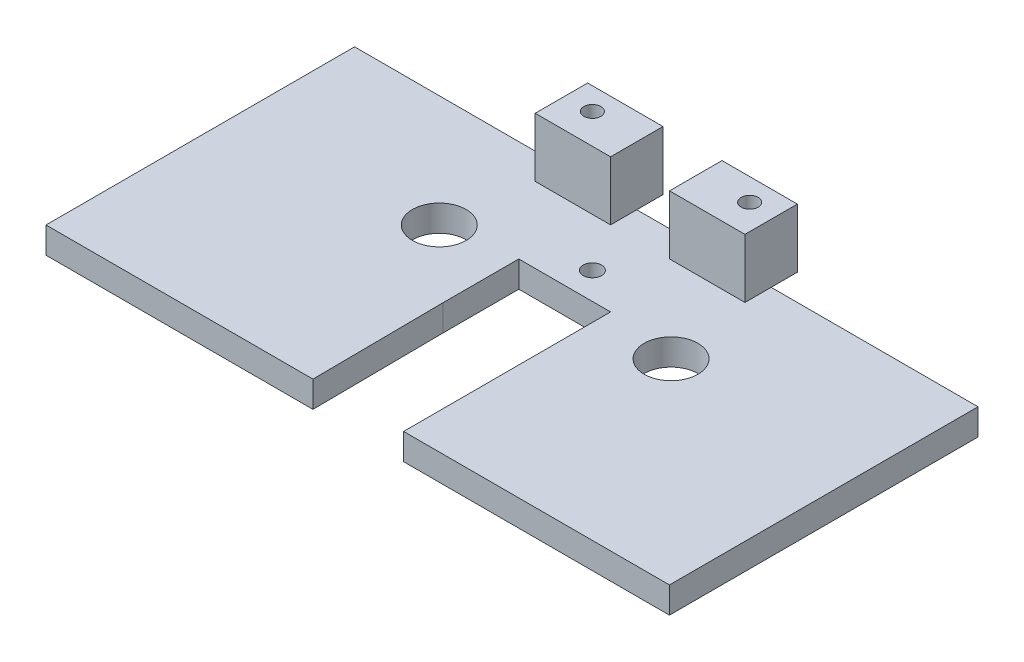
from build123d import *

# Parameters (mm, degrees)
SKETCH2_R           = 2.05
SKETCH2_R_2         = 0.700643725
BOSS_EXTRUDE1_DEPTH = 2
SKETCH3_W           = 5.75
SKETCH3_H           = 4
BOSS_EXTRUDE2_DEPTH = 4.5
SKETCH4_R           = 0.65
CUT_EXTRUDE1_DEPTH  = 18.578324987
BOSS_EXTRUDE3_DEPTH = 2


with BuildPart() as part:
    # Sketch2 → Boss-Extrude1 (new body)
    with BuildSketch(Plane(origin=(0, 0, 0), x_dir=(1, 0, 0), z_dir=(0, 1, 0))):
        Polygon((-3.5, -6.76929), (-3.5, -0.98071), (3.5, -0.98071), (3.5, -6.76929), (13.7785, -6.76929), (13.7785, 6.76929), (-13.7785, 6.76929), (-13.7785, -6.76929), align=None)
        with Locations(Location((-8.7785, -1.76929, 0), (0, 0, 270))):
            Circle(SKETCH2_R, mode=Mode.SUBTRACT)
        with Locations(Location((8.9015, -1.76929, 0), (0, 0, 270))):
            Circle(SKETCH2_R, mode=Mode.SUBTRACT)
        with Locations(Location((0.0585, 1.07400228, 0), (0, 0, 270))):
            Circle(SKETCH2_R_2, mode=Mode.SUBTRACT)
    extrude(amount=BOSS_EXTRUDE1_DEPTH)

    # Sketch3 → Boss-Extrude2 (add)
    with BuildSketch(Plane(origin=(0, 2, 0), x_dir=(1, 0, 0), z_dir=(0, 1, 0))):
        with Locations((-5.125, 6.76929)):
            Rectangle(SKETCH3_W, SKETCH3_H)
        with Locations((5.125, 6.76929)):
            Rectangle(SKETCH3_W, SKETCH3_H)
    extrude(amount=BOSS_EXTRUDE2_DEPTH)

    # Sketch4 → Cut-Extrude1 (cut, through all)
    with BuildSketch(Plane(origin=(0, 6.5, 0), x_dir=(1, 0, 0), z_dir=(0, 1, 0))):
        with Locations(Location((-5.94, 7.06929, 0), (0, 0, 270))):
            Circle(SKETCH4_R)
        with Locations(Location((6.06, 7.06929, 0), (0, 0, 270))):
            Circle(SKETCH4_R)
    extrude(amount=-CUT_EXTRUDE1_DEPTH, mode=Mode.SUBTRACT)

    # Sketch5 → Boss-Extrude3 (add)
    with BuildSketch(Plane(origin=(0, 2, 0), x_dir=(1, 0, 0), z_dir=(0, 1, 0))):
        Polygon((-13.7785, 6.76929), (-23.7785, 6.76929), (-23.7785, -16.768919175), (-3.413881725, -16.768919175), (-3.5, -6.76929), (-13.7785, -6.76929), align=None)
        Polygon((3.5, -6.76929), (3.5, -16.768919175), (23.7785, -16.768919175), (23.7785, 6.76929), (13.7785, 6.76929), (13.7785, -6.76929), align=None)
    extrude(amount=-BOSS_EXTRUDE3_DEPTH)


solid = part.part
